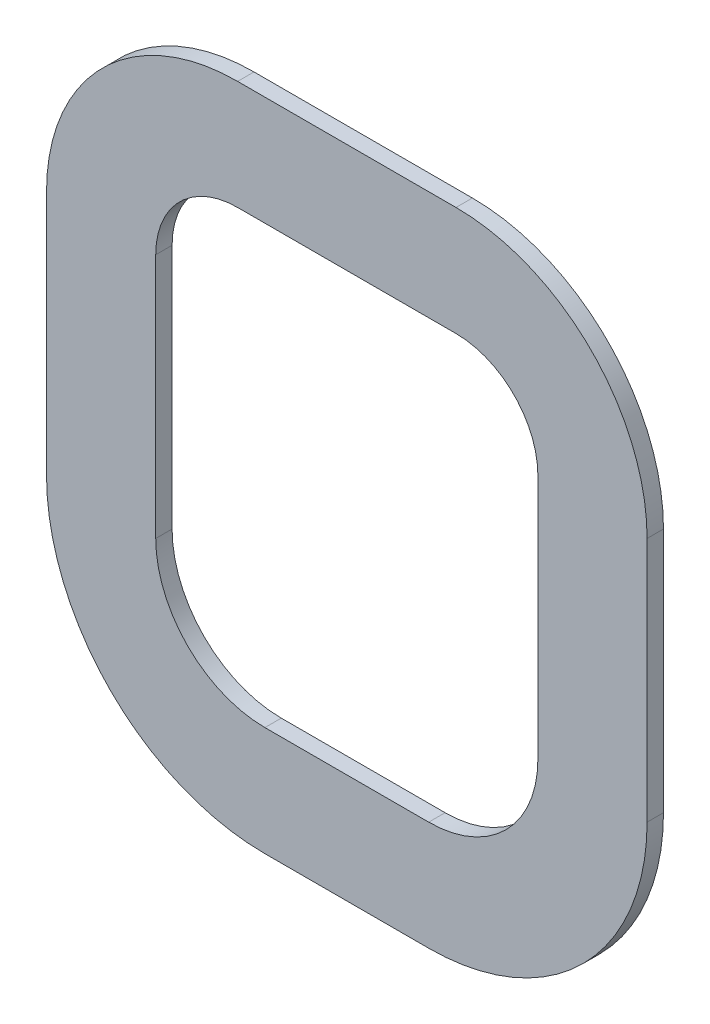
from build123d import *

# Parameters (mm, degrees)
BOSS_EXTRUDE1_DEPTH = 3


with BuildPart() as part:
    # Sketch1 → Boss-Extrude1 (new body)
    with BuildSketch(Plane.XY):
        with BuildLine():
            Line((-20, 52), (20, 52))
            ThreePointArc((20, 52), (44.748737342, 41.748737342), (55, 17))
            Line((55, 17), (55, -28))
            ThreePointArc((55, -28), (43.284271247, -56.284271247), (15, -68))
            Line((15, -68), (0.5, -68))
            Line((0.5, -68), (-0.5, -68))
            Line((-0.5, -68), (-15, -68))
            ThreePointArc((-15, -68), (-43.284271247, -56.284271247), (-55, -28))
            Line((-55, -28), (-55, 17))
            ThreePointArc((-55, 17), (-44.748737342, 41.748737342), (-20, 52))
        make_face()
        with BuildLine():
            Line((-20, 32), (20, 32))
            ThreePointArc((20, 32), (30.606601718, 27.606601718), (35, 17))
            Line((35, 17), (35, -28))
            ThreePointArc((35, -28), (29.142135624, -42.142135624), (15, -48))
            Line((15, -48), (0.5, -48))
            Line((0.5, -48), (-0.5, -48))
            Line((-0.5, -48), (-15, -48))
            ThreePointArc((-15, -48), (-29.142135624, -42.142135624), (-35, -28))
            Line((-35, -28), (-35, 17))
            ThreePointArc((-35, 17), (-30.606601718, 27.606601718), (-20, 32))
        make_face(mode=Mode.SUBTRACT)
    extrude(amount=BOSS_EXTRUDE1_DEPTH)


solid = part.part
